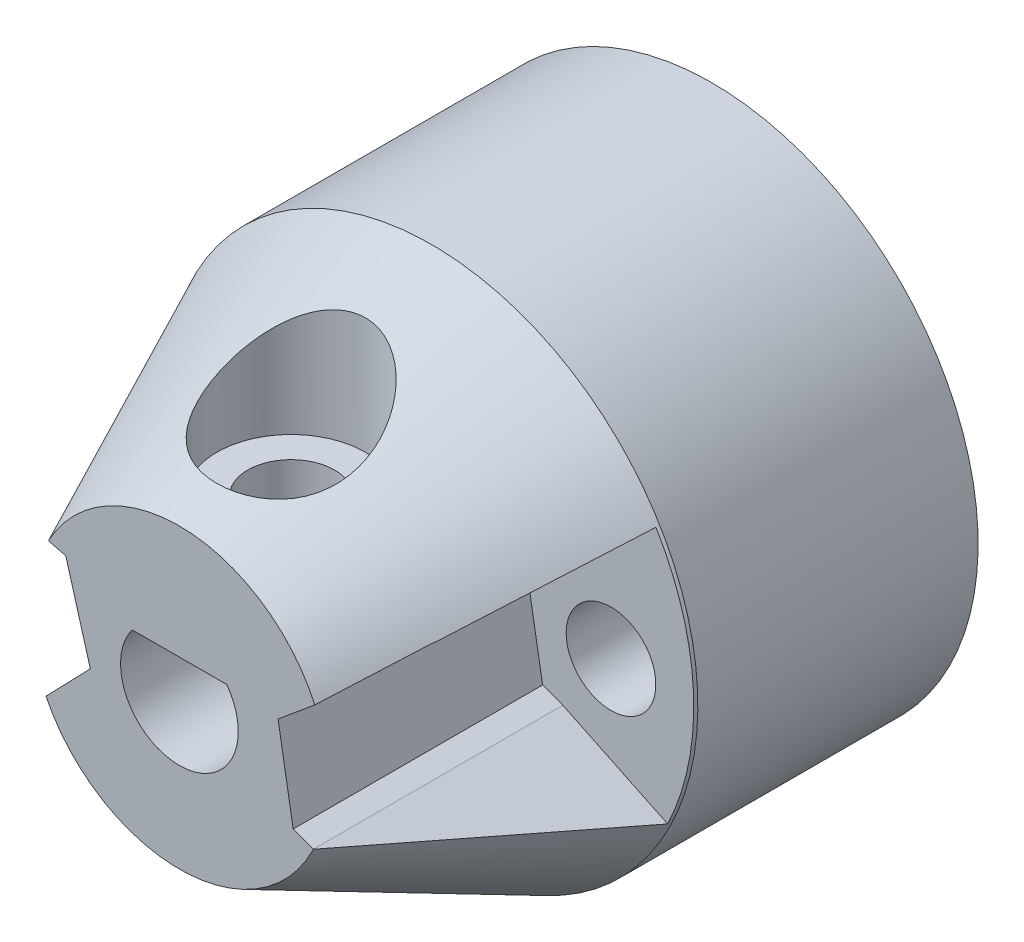
from build123d import *

# Parameters (mm, degrees)
ESBO_O2_R                   = 9.5
RESSALTO_EXTRUS_O3_DEPTH    = 9
RESSALTO_EXTRUS_O3_TAPER    = 25
CORTE_EXTRUS_O1_DEPTH       = 8
CORTE_EXTRUS_O4_DEPTH       = 10
CORTE_EXTRUS_O4_DEPTH_BACK  = 8
ESBO_O12_R                  = 1.55
CORTE_EXTRUS_O5_DEPTH       = 5
CORTE_EXTRUS_O5_DEPTH_BACK  = 8
ESBO_O20_R                  = 2.65
CORTE_EXTRUS_O6_DEPTH       = 9.8
CORTE_EXTRUS_O6_DEPTH_BACK  = 10
ESBO_O36_R                  = 1.6
CORTE_EXTRUS_O8_DEPTH       = 10
RESSALTO_EXTRUS_O4_START    = 10
ESBO_O36_3_R                = 9.5
ESBO_O36_3_R_2              = 1.6
ESBO_O36_3_R_3              = 4
RESSALTO_EXTRUS_O4_DEPTH    = 10
CORTE_EXTRUS_O10_DEPTH      = 10
CORTE_EXTRUS_O10_DEPTH_BACK = 9.9
CORTE_EXTRUS_O11_DEPTH      = 9.9
CORTE_EXTRUS_O11_DEPTH_BACK = 9.9


with BuildPart() as part:
    # Esboço2 → Ressalto-extrusão3 (new body)
    with BuildSketch(Plane.XY.offset(10)):
        Circle(ESBO_O2_R)
    extrude(amount=RESSALTO_EXTRUS_O3_DEPTH, taper=RESSALTO_EXTRUS_O3_TAPER)

    # Esboço8 → Corte-extrusão1 (cut)
    with BuildSketch(Plane.XY.offset(19)):
        with BuildLine():
            ThreePointArc((-1.687453703, 1.25), (0, -2.1), (1.687453703, 1.25))
            Line((1.687453703, 1.25), (-1.687453703, 1.25))
        make_face()
    extrude(amount=-CORTE_EXTRUS_O1_DEPTH, mode=Mode.SUBTRACT)

    # Esboço12 → Corte-extrusão4 (cut, two sides: drawn at the far end of the back side and taken through both)
    with BuildSketch(Plane(origin=(0, 9.25, 0), x_dir=(-1, 0, 0), z_dir=(0, -1, 0)).offset(-CORTE_EXTRUS_O4_DEPTH_BACK)):
        with Locations((0.013800593, -14.999427624)):
            Circle(ESBO_O12_R)
    extrude(amount=CORTE_EXTRUS_O4_DEPTH + CORTE_EXTRUS_O4_DEPTH_BACK, mode=Mode.SUBTRACT)

    # Esboço20 → Corte-extrusão5 (cut, two sides: drawn at the far end of the back side and taken through both)
    with BuildSketch(Plane(origin=(0, 9.25, 0), x_dir=(-1, 0, 0), z_dir=(0, -1, 0)).offset(-CORTE_EXTRUS_O5_DEPTH_BACK)):
        with Locations((0.013800593, -14.999427624)):
            Circle(ESBO_O20_R)
    extrude(amount=CORTE_EXTRUS_O5_DEPTH + CORTE_EXTRUS_O5_DEPTH_BACK, mode=Mode.SUBTRACT)

    # Esboço25 → Corte-extrusão6 (cut, two sides: drawn at the far end of the back side and taken through both)
    with BuildSketch(Plane(origin=(0, 0, 20), x_dir=(-1, 0, 0), z_dir=(0, 0, -1)).offset(-CORTE_EXTRUS_O6_DEPTH_BACK)):
        Polygon((7.134775628, 3.121360799), (4.053715986, 2.352982757), (3.178621068, -0.699482185), (5.384585793, -2.983569084), (8.465645436, -2.215191043), (9.340740353, 0.837273899), align=None)
        Polygon((-5.961169976, 3.129376222), (-8.940704294, 2.0313286), (-9.479534318, -1.098047621), (-7.038830024, -3.129376222), (-4.059295706, -2.0313286), (-3.520465682, 1.098047621), align=None)
    extrude(amount=CORTE_EXTRUS_O6_DEPTH + CORTE_EXTRUS_O6_DEPTH_BACK, mode=Mode.SUBTRACT)

    # Esboço36 → Corte-extrusão8 (cut)
    with BuildSketch(Plane(origin=(0, 0, 10), x_dir=(-1, 0, 0), z_dir=(0, 0, -1))):
        with Locations((-6.5, 0)):
            Circle(ESBO_O36_R)
        with Locations((6.5, 0)):
            Circle(ESBO_O36_R)
    extrude(amount=-CORTE_EXTRUS_O8_DEPTH, mode=Mode.SUBTRACT)

    # Esboço36<3> → Ressalto-extrusão4 (add)
    # profile 1 of 2: a face of its own
    with BuildSketch(Plane(origin=(0, 0, 10), x_dir=(-1, 0, 0), z_dir=(0, 0, -1)).offset(RESSALTO_EXTRUS_O4_START)):
        Circle(ESBO_O36_3_R)
        with Locations((-6.5, 0)):
            Circle(ESBO_O36_3_R_2, mode=Mode.SUBTRACT)
        Circle(ESBO_O36_3_R_3, mode=Mode.SUBTRACT)
        with Locations((6.5, 0)):
            Circle(ESBO_O36_3_R_2, mode=Mode.SUBTRACT)
    # profile 2 of 2: a face of its own
    with BuildSketch(Plane(origin=(0, 0, 10), x_dir=(-1, 0, 0), z_dir=(0, 0, -1)).offset(RESSALTO_EXTRUS_O4_START)):
        with BuildLine():
            Line((0.99979998, 0.98), (-0.99979998, 0.98))
            ThreePointArc((-0.99979998, 0.98), (0, -1.4), (0.99979998, 0.98))
        make_face()
    extrude(amount=-RESSALTO_EXTRUS_O4_DEPTH)

    # Esboço49 → Corte-extrusão10 (cut, two sides: drawn at the far end of the back side and taken through both)
    with BuildSketch(Plane(origin=(0, 0, 20), x_dir=(-1, 0, 0), z_dir=(0, 0, -1)).offset(-CORTE_EXTRUS_O10_DEPTH_BACK)):
        with BuildLine():
            Line((8.371054684, 4.491708302), (4.673014458, 2.507428111))
            Line((4.673014458, 2.507428111), (4.053715986, 2.352982757))
            Line((4.053715986, 2.352982757), (3.178621068, -0.699482185))
            Line((3.178621068, -0.699482185), (4.760398724, -2.337277014))
            Line((4.760398724, -2.337277014), (7.818914356, -5.395792647))
            ThreePointArc((7.818914356, -5.395792647), (9.069996868, -2.825801976), (9.5, 0))
            ThreePointArc((9.5, 0), (9.213441797, 2.31570513), (8.371054684, 4.491708302))
        make_face()
    extrude(amount=CORTE_EXTRUS_O10_DEPTH + CORTE_EXTRUS_O10_DEPTH_BACK, mode=Mode.SUBTRACT)

    # Esboço49<4> → Corte-extrusão11 (cut, two sides: drawn at the far end of the back side and taken through both)
    with BuildSketch(Plane(origin=(0, 0, 20), x_dir=(-1, 0, 0), z_dir=(0, 0, -1)).offset(-CORTE_EXTRUS_O11_DEPTH_BACK)):
        with BuildLine():
            Line((-3.520465682, 1.098047621), (-4.830623712, 2.188454798))
            Line((-4.830623712, 2.188454798), (-8.141518287, 4.89547546))
            ThreePointArc((-8.141518287, 4.89547546), (-9.48963755, 0.443597976), (-8.562700205, -4.114628197))
            Line((-8.562700205, -4.114628197), (-4.779997666, -2.296928855))
            Line((-4.779997666, -2.296928855), (-4.059295706, -2.0313286))
            Line((-4.059295706, -2.0313286), (-3.520465682, 1.098047621))
        make_face()
    extrude(amount=CORTE_EXTRUS_O11_DEPTH + CORTE_EXTRUS_O11_DEPTH_BACK, mode=Mode.SUBTRACT)


solid = part.part
